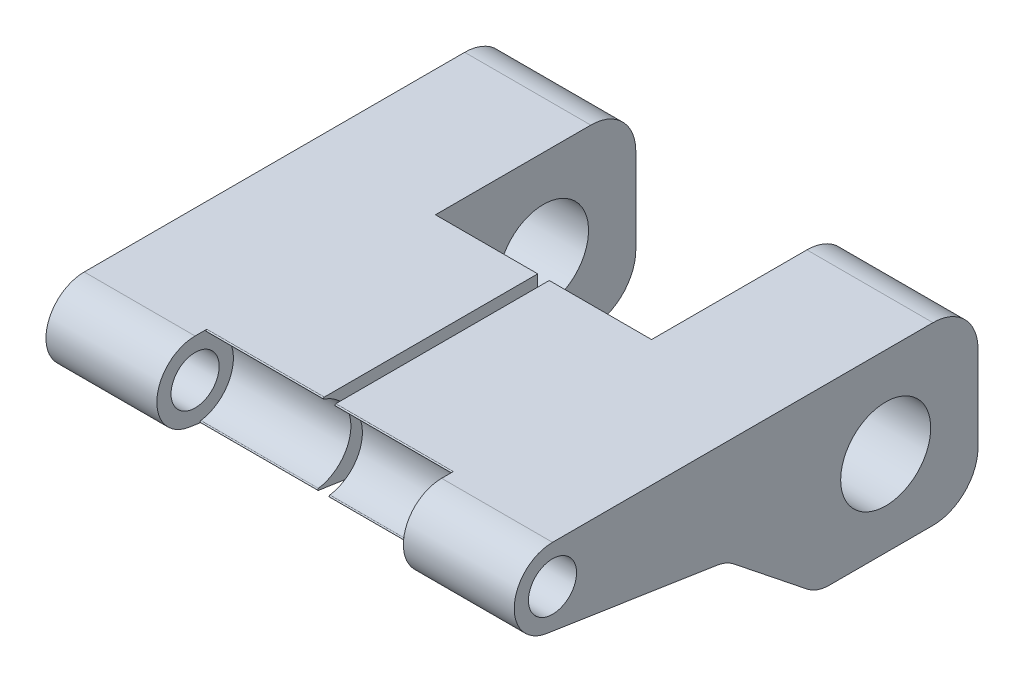
from build123d import *

# Parameters (mm, degrees)
SKETCH_1_R          = 2.5
SKETCH_1_R_2        = 2.125
SKETCH_1_R_3        = 1.335133797
EXTRUDE_1_DEPTH     = 13
SKETCH_2_W          = 6.524253829
SKETCH_2_H          = 2.585648983
CUT_EXTRUDE_2_DEPTH = 120.959693752
CUT_EXTRUDE_3_DEPTH = 98.45681871
CUT_EXTRUDE_4_DEPTH = 98.45681871
FILLET_1_R          = 1


with BuildPart() as part:
    # 草图1 → 凸台-拉伸1 (new body)
    # profile 1 of 2: a face of its own
    with BuildSketch(Plane(origin=(57.25, 0, 0), x_dir=(0, 0, -1), z_dir=(1, 0, 0))):
        with BuildLine():
            Line((-61.875, -37.25), (-68.322437436, -37.25))
            Line((-68.322437436, -37.25), (-83, -37.25))
            ThreePointArc((-83, -37.25), (-81.49739809, -37.87239809), (-80.875, -39.375))
            ThreePointArc((-80.875, -39.375), (-81.615466865, -40.987046214), (-83.320828703, -41.475641317))
            Line((-83.320828703, -41.475641317), (-73.867519615, -42.91943511))
            ThreePointArc((-73.867519615, -42.91943511), (-73.3680524, -43.064100999), (-72.922760566, -43.332635727))
            Line((-72.922760566, -43.332635727), (-68.869512223, -46.563873564))
            ThreePointArc((-68.869512223, -46.563873564), (-68.283195443, -46.88782244), (-67.622796748, -47))
            Line((-67.622796748, -47), (-61.875, -47))
            ThreePointArc((-61.875, -47), (-60.107233047, -46.267766953), (-59.375, -44.5))
            Line((-59.375, -44.5), (-59.375, -39.75))
            ThreePointArc((-59.375, -39.75), (-60.107233047, -37.982233047), (-61.875, -37.25))
        make_face()
        with Locations(Location((-64.5, -42.25, 0), (0, 0, 180))):
            Circle(SKETCH_1_R, mode=Mode.SUBTRACT)
    # profile 2 of 2: a face of its own
    with BuildSketch(Plane(origin=(57.25, 0, 0), x_dir=(0, 0, -1), z_dir=(1, 0, 0))):
        with Locations((-83, -39.375)):
            Circle(SKETCH_1_R_2)
        with Locations(Location((-83, -39.375, 0), (0, 0, 180))):
            Circle(SKETCH_1_R_3, mode=Mode.SUBTRACT)
    extrude(amount=EXTRUDE_1_DEPTH)

    # 草图2 → 切除-拉伸2 (cut, through all)
    with BuildSketch(Plane(origin=(0, 0, 0), x_dir=(1, 0, 0), z_dir=(0, 1, 0))):
        Polygon((57.569510981, -70.5), (63.25, -70.5), (63.25, -57.795794402), (56.681632837, -57.795794402), (56.681632837, -70.222083514), (57.569510981, -70.222083514), align=None)
        Polygon((57.569510981, -83), (57.569510981, -70.5), (56.681632837, -70.5), (56.681632837, -83), (57.25, -83), align=None)
        with Locations((60.831637896, -84.292824491)):
            Rectangle(SKETCH_2_W, SKETCH_2_H)
        Polygon((57.569510981, -85.585648983), (57.569510981, -83), (57.25, -83), (56.681632837, -83), (56.681632837, -85.585648983), align=None)
    extrude(amount=-CUT_EXTRUDE_2_DEPTH, mode=Mode.SUBTRACT)


with BuildPart() as cut_extrude_2_kept_piece:
    # of the separate pieces the step leaves, the one the design keeps (cut_extrude_2_pieces_kept)
    add(part.part.solids().sort_by_distance((63.25, -37.25, 61.875))[0])

    # 草图3 → 切除-拉伸3 (cut, through all)
    with BuildSketch(Plane.ZY.offset(-64.09376481)):
        with BuildLine():
            ThreePointArc((85.125, -39.375), (84.50260191, -37.87239809), (83, -37.25))
            Line((83, -37.25), (83, -38.039866203))
            ThreePointArc((83, -38.039866203), (84.335133797, -39.375), (83, -40.710133797))
            Line((83, -40.710133797), (83, -41.5))
            ThreePointArc((83, -41.5), (83.160876041, -41.493901579), (83.320828703, -41.475641317))
            ThreePointArc((83.320828703, -41.475641317), (84.612046214, -40.759533135), (85.125, -39.375))
        make_face()
        with BuildLine():
            Line((83, -38.039866203), (83, -37.25))
            ThreePointArc((83, -37.25), (80.875, -39.375), (83, -41.5))
            Line((83, -41.5), (83, -40.710133797))
            ThreePointArc((83, -40.710133797), (84.335133797, -39.375), (83, -38.039866203))
        make_face()
        with BuildLine():
            ThreePointArc((85.125, -39.375), (84.50260191, -37.87239809), (83, -37.25))
            Line((83, -37.25), (83, -38.039866203))
            ThreePointArc((83, -38.039866203), (84.335133797, -39.375), (83, -40.710133797))
            Line((83, -40.710133797), (83, -41.5))
            ThreePointArc((83, -41.5), (83.160876041, -41.493901579), (83.320828703, -41.475641317))
            ThreePointArc((83.320828703, -41.475641317), (84.612046214, -40.759533135), (85.125, -39.375))
        make_face()
    extrude(amount=CUT_EXTRUDE_3_DEPTH, mode=Mode.SUBTRACT)

    # 草图4 → 切除-拉伸4 (cut, through all)
    with BuildSketch(Plane.ZY.offset(-64.09376481)):
        with BuildLine():
            Line((83, -37.25), (82.348079759, -37.25))
            ThreePointArc((82.348079759, -37.25), (82.397501705, -37.29241902), (82.363066432, -37.347701149))
            ThreePointArc((82.363066432, -37.347701149), (82.677808331, -37.2745673), (83, -37.25))
        make_face()
        with BuildLine():
            ThreePointArc((83, -41.5), (82.837749118, -41.493796746), (82.676445515, -41.475223201))
            ThreePointArc((82.676445515, -41.475223201), (82.718832444, -41.524672669), (82.676381359, -41.574067071))
            Line((82.676381359, -41.574067071), (83, -41.524641142))
            Line((83, -41.524641142), (83, -41.5))
        make_face()
    extrude(amount=CUT_EXTRUDE_4_DEPTH, mode=Mode.SUBTRACT)

    # 圆角1
    fillet_1_edges = [cut_extrude_2_kept_piece.edges().sort_by_distance(p)[0] for p in [
        (60.409755491, -45.264053432, 70.5),
    ]]
    fillet(fillet_1_edges, radius=FILLET_1_R)


with BuildPart() as body_2:
    # 镜向2: mirrored copy
    add(cut_extrude_2_kept_piece.part.mirror(Plane(origin=(57.25, 0, 0), x_dir=(0, 0, 1), z_dir=(1, 0, 0))))


with BuildPart() as body_2_2:
    # 镜向3: mirrored copy
    add(cut_extrude_2_kept_piece.part.mirror(Plane(origin=(57.25, 0, 0), x_dir=(0, 0, 1), z_dir=(1, 0, 0))))


solid = Compound([cut_extrude_2_kept_piece.part, body_2_2.part])
